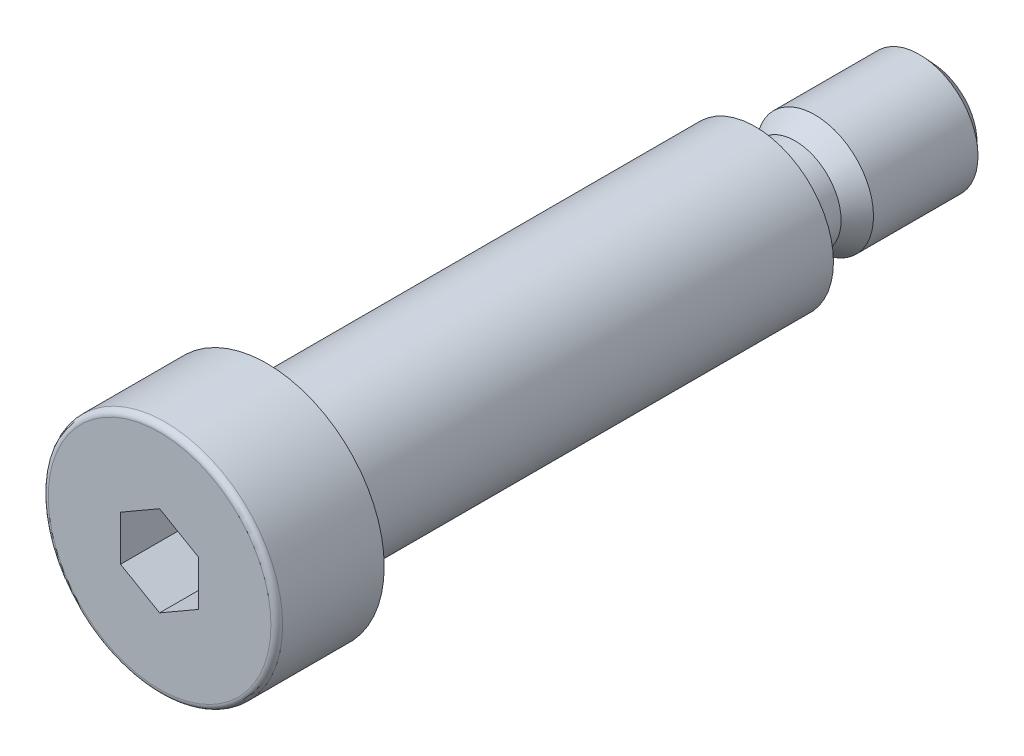
from build123d import *

# Parameters (mm, degrees)
SZKIC1_W                   = 4.7
SZKIC1_H                   = 4.08
WYTNIJ_WYCI_GNI_CIE1_DEPTH = 6.6
ZAOKR_GLENIE1_R            = 0.6


with BuildPart() as part:
    # Szkic1 → Obrót1 (revolve)
    with BuildSketch(Plane(origin=(0, 0, 0), x_dir=(1, 0, 0), z_dir=(0, 1, 0)), mode=Mode.PRIVATE) as obr_t1_sk:
        Polygon((0, -36), (0, -25), (-8, -25), (-12, -25), (-12, -36), align=None)
        Polygon((0, -25), (0, 25), (-4.7, 25), (-8, 25), (-8, -25), align=None)
        with Locations((-2.35, 27.04)):
            Rectangle(SZKIC1_W, SZKIC1_H)
        Polygon((-4.7, 29.08), (0, 29.08), (0, 43), (-4.7, 43), (-6, 41.8), (-6, 31.1), align=None)
    revolve(obr_t1_sk.sketch.rotate(Axis((0, 0, 36), (0, 0, -1)), 180), axis=Axis((0, 0, 36), (0, 0, -1)))

    # Szkic2 → Wytnij-wyciągnięcie1 (cut)
    with BuildSketch(Plane.XY.offset(36)):
        Polygon((4, 2.309401077), (0, 4.618802154), (-4, 2.309401077), (-4, -2.309401077), (0, -4.618802154), (4, -2.309401077), align=None)
    extrude(amount=-WYTNIJ_WYCI_GNI_CIE1_DEPTH, mode=Mode.SUBTRACT)

    # Zaokrąglenie1
    zaokr_glenie1_edges = [part.edges().sort_by_distance(p)[0] for p in [
        (-12, 0, 36),
    ]]
    fillet(zaokr_glenie1_edges, radius=ZAOKR_GLENIE1_R)


solid = part.part
